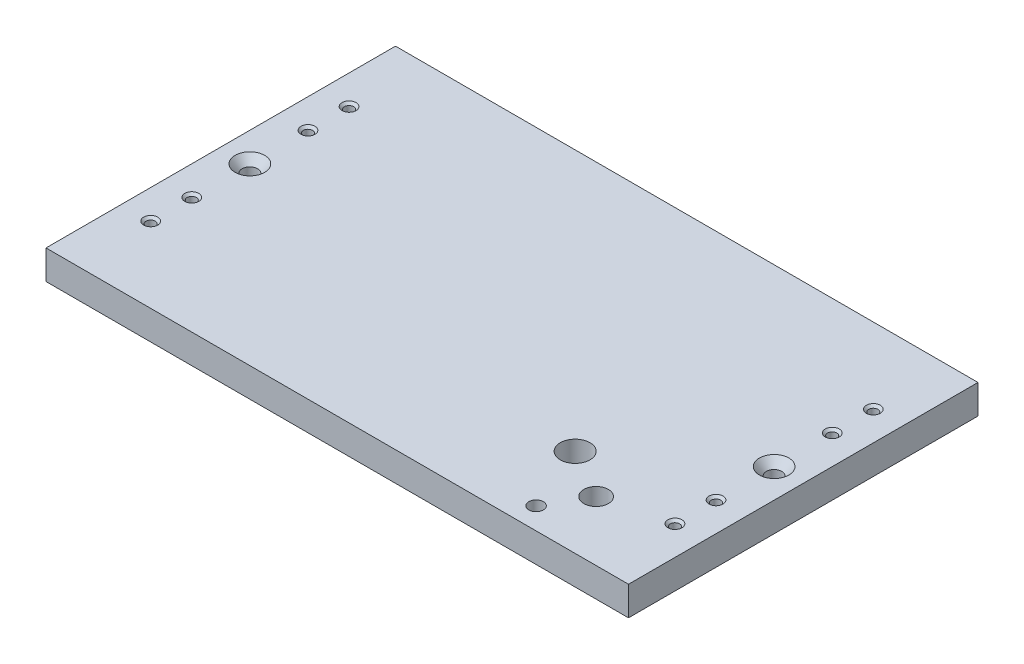
from build123d import *

# Parameters (mm, degrees)
SKETCH1_W                                        = 254
SKETCH1_H                                        = 152.4
BOSS_EXTRUDE1_DEPTH                              = 12.7
SKETCH2_W                                        = 203.2
SKETCH2_H                                        = 63.5
CUT_EXTRUDE1_DEPTH                               = 149.649688866
SKETCH11_W                                       = 203.2
SKETCH11_H                                       = 63.5
BOSS_EXTRUDE2_DEPTH                              = 12.7
SKETCH13_R                                       = 5.3578125
SKETCH13_R_2                                     = 6.4897
CUT_EXTRUDE8_DEPTH                               = 149.649688866
SKETCH14_R                                       = 3.1623
CUT_EXTRUDE9_DEPTH                               = 149.649688866
F_10_32_TAPPED_HOLE2_D                           = 4.0386
F_10_32_TAPPED_HOLE2_CSINK_D                     = 6.096
F_10_32_TAPPED_HOLE2_CSINK_ANGLE                 = 90
MIRROR2_COPY_1_D                                 = 4.0386
MIRROR2_COPY_1_CSINK_D                           = 6.096
MIRROR2_COPY_1_CSINK_ANGLE                       = 90
CSK_FOR_1_4_FLAT_HEAD_MACHINE_SCREW1_D           = 6.7564
CSK_FOR_1_4_FLAT_HEAD_MACHINE_SCREW1_CSINK_D     = 12.8778
CSK_FOR_1_4_FLAT_HEAD_MACHINE_SCREW1_CSINK_ANGLE = 82


with BuildPart() as part:
    # Sketch1 → Boss-Extrude1 (new body)
    with BuildSketch(Plane(origin=(0, 0, 0), x_dir=(1, 0, 0), z_dir=(0, 1, 0))):
        Rectangle(SKETCH1_W, SKETCH1_H)
    extrude(amount=BOSS_EXTRUDE1_DEPTH)

    # Sketch2 → Cut-Extrude1 (cut, through all)
    with BuildSketch(Plane(origin=(0, 12.7, 0), x_dir=(1, 0, 0), z_dir=(0, 1, 0))):
        with Locations((0, -44.45)):
            Rectangle(SKETCH2_W, SKETCH2_H)
        with Locations((0, 44.45)):
            Rectangle(SKETCH2_W, SKETCH2_H)
    extrude(amount=-CUT_EXTRUDE1_DEPTH, mode=Mode.SUBTRACT)

    # Sketch11 → Boss-Extrude2 (add)
    with BuildSketch(Plane(origin=(0, 12.7, 0), x_dir=(1, 0, 0), z_dir=(0, 1, 0))):
        with Locations((0, 44.45)):
            Rectangle(SKETCH11_W, SKETCH11_H)
        with Locations((0, -44.45)):
            Rectangle(SKETCH11_W, SKETCH11_H)
    extrude(amount=-BOSS_EXTRUDE2_DEPTH)

    # Sketch13 → Cut-Extrude8 (cut, through all)
    with BuildSketch(Plane(origin=(0, 12.7, 0), x_dir=(1, 0, 0), z_dir=(0, 1, 0))):
        with Locations(Location((86.819046868, -50.12500008, 0), (0, 0, 270))):
            Circle(SKETCH13_R)
        with Locations(Location((65.16841174, -37.625000061, 0), (0, 0, 270))):
            Circle(SKETCH13_R_2)
    extrude(amount=-CUT_EXTRUDE8_DEPTH, mode=Mode.SUBTRACT)

    # Sketch14 → Cut-Extrude9 (cut, through all)
    with BuildSketch(Plane(origin=(0, 12.7, 0), x_dir=(1, 0, 0), z_dir=(0, 1, 0))):
        with Locations(Location((77.237896866, -66.720038678, 0), (0, 0, 270))):
            Circle(SKETCH14_R)
    extrude(amount=-CUT_EXTRUDE9_DEPTH, mode=Mode.SUBTRACT)

    # #10-32 Tapped Hole2 (through all)
    with Locations(Plane(origin=(0, 12.7, 0), x_dir=(1, 0, 0), z_dir=(0, 1, 0))):
        with Locations((-114.3, -25.3365), (-114.3, -43.2435)):
            f_10_32_tapped_hole2 = CounterSinkHole(F_10_32_TAPPED_HOLE2_D / 2, F_10_32_TAPPED_HOLE2_CSINK_D / 2, counter_sink_angle=F_10_32_TAPPED_HOLE2_CSINK_ANGLE)

    # Mirror1: #10-32 Tapped Hole2 across plane
    add(f_10_32_tapped_hole2.mirror(Plane.XY), mode=Mode.SUBTRACT)

    # Mirror2: #10-32 Tapped Hole2 across plane
    add(f_10_32_tapped_hole2.mirror(Plane(origin=(0, 0, 0), x_dir=(0, 0, 1), z_dir=(1, 0, 0))), mode=Mode.SUBTRACT)

    # Mirror2 copy 1 (through all)
    with Locations(Plane(origin=(0, 12.7, 0), x_dir=(-1, 0, 0), z_dir=(0, 1, 0))):
        with Locations((-114.3, -25.3365), (-114.3, -43.2435)):
            CounterSinkHole(MIRROR2_COPY_1_D / 2, MIRROR2_COPY_1_CSINK_D / 2, counter_sink_angle=MIRROR2_COPY_1_CSINK_ANGLE)

    # CSK for 1/4 Flat Head Machine Screw1 (through all)
    with Locations(Plane(origin=(0, 12.7, 0), x_dir=(1, 0, 0), z_dir=(0, 1, 0))):
        with Locations((-114.3, 0)):
            csk_for_1_4_flat_head_machine_screw1 = CounterSinkHole(CSK_FOR_1_4_FLAT_HEAD_MACHINE_SCREW1_D / 2, CSK_FOR_1_4_FLAT_HEAD_MACHINE_SCREW1_CSINK_D / 2, counter_sink_angle=CSK_FOR_1_4_FLAT_HEAD_MACHINE_SCREW1_CSINK_ANGLE)

    # Mirror3: CSK for 1/4 Flat Head Machine Screw1 across plane
    add(csk_for_1_4_flat_head_machine_screw1.mirror(Plane(origin=(0, 0, 0), x_dir=(0, 0, 1), z_dir=(1, 0, 0))), mode=Mode.SUBTRACT)


solid = part.part
